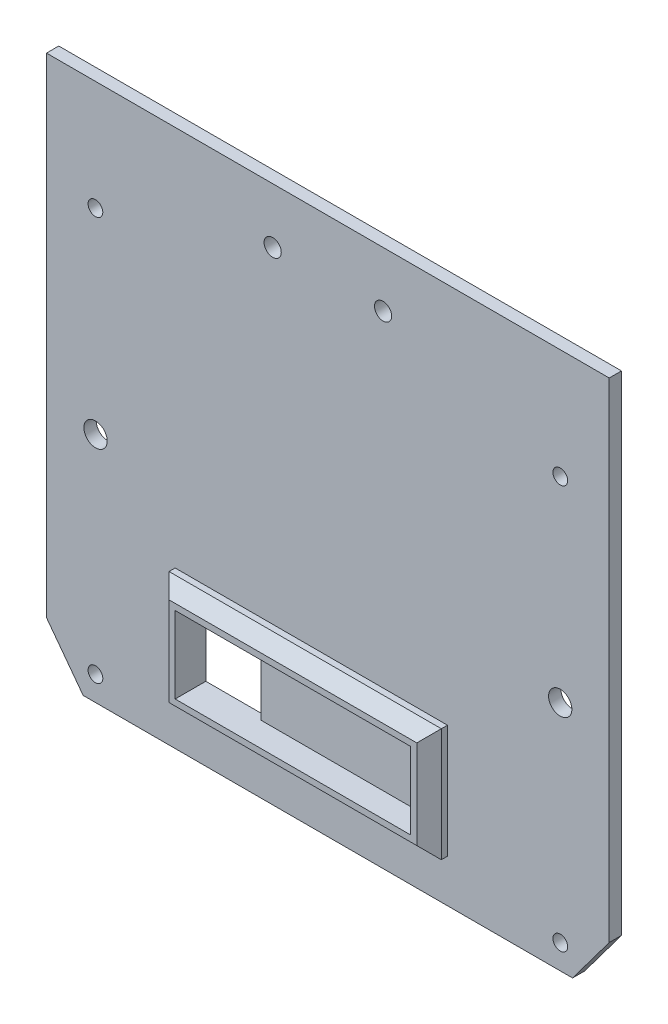
from build123d import *

# Parameters (mm, degrees)
SKETCH_1_W          = 6.2
SKETCH_1_H          = 6.2
SKETCH_1_R          = 1.2
EXTRUDE_1_DEPTH     = 2
CUT_EXTRUDE_1_DEPTH = 1
SKETCH_3_W          = 10
SKETCH_3_H          = 12.5
CUT_EXTRUDE_2_DEPTH = 1
SKETCH_4_W          = 44.4
SKETCH_4_H          = 18.5
SKETCH_4_W_2        = 38.4
SKETCH_4_H_2        = 12.5
EXTRUDE_2_DEPTH     = 3
CHAMFER_2_SIZE      = 2
SKETCH_5_W          = 6.2
SKETCH_5_H          = 6.2
EXTRUDE_3_DEPTH     = 2
CUT_EXTRUDE_3_DEPTH = 10
EXTRUDE_4_DEPTH     = 2
SKETCH_8_R          = 1.9
CUT_EXTRUDE_4_DEPTH = 10


with BuildPart() as part:
    # 草图1 → 凸台-拉伸1 (new body)
    with BuildSketch(Plane.XY):
        Polygon((-68.63, 16.2), (-64.63, 12.2), (-64.63, -37.62), (-68.63, -41.62), (-68.63, -49.62), (11.17, -49.62), (11.17, -41.62), (7.17, -37.62), (7.17, 12.2), (11.17, 16.2), (11.17, 38.1), (-68.63, 38.1), align=None)
        with Locations((-37.93, 28.38)):
            Rectangle(SKETCH_1_W, SKETCH_1_H, mode=Mode.SUBTRACT)
        with Locations((-27.73, 28.38)):
            Rectangle(SKETCH_1_W, SKETCH_1_H, mode=Mode.SUBTRACT)
        with Locations((-66.63, -45.62)):
            Circle(SKETCH_1_R, mode=Mode.SUBTRACT)
        with Locations((9.17, -45.62)):
            Circle(SKETCH_1_R, mode=Mode.SUBTRACT)
        with Locations((-66.63, 20.2)):
            Circle(SKETCH_1_R, mode=Mode.SUBTRACT)
        with Locations((9.17, 20.2)):
            Circle(SKETCH_1_R, mode=Mode.SUBTRACT)
    extrude(amount=EXTRUDE_1_DEPTH)

    # 草图2 → 切除-拉伸1 (cut)
    with BuildSketch(Plane.XY.offset(2)):
        Polygon((-12.23, -27.12), (-39.83, -27.12), (-39.83, -35.02), (-39.83, -39.62), (-12.23, -39.62), align=None)
        Polygon((-39.83, -27.12), (-50.63, -27.12), (-50.63, -39.62), (-39.83, -39.62), (-39.83, -35.02), align=None)
    extrude(amount=-CUT_EXTRUDE_1_DEPTH, mode=Mode.SUBTRACT)

    # 草图3 → 切除-拉伸2 (cut)
    with BuildSketch(Plane.XY.offset(1)):
        with Locations((-45.63, -33.37)):
            Rectangle(SKETCH_3_W, SKETCH_3_H)
    extrude(amount=-CUT_EXTRUDE_2_DEPTH, mode=Mode.SUBTRACT)

    # 草图4 → 凸台-拉伸2 (add)
    with BuildSketch(Plane.XY.offset(2)):
        with Locations((-31.43, -33.37)):
            Rectangle(SKETCH_4_W, SKETCH_4_H)
        with Locations((-31.43, -33.37)):
            Rectangle(SKETCH_4_W_2, SKETCH_4_H_2, mode=Mode.SUBTRACT)
    extrude(amount=EXTRUDE_2_DEPTH)

    # 倒角2
    chamfer_2_edges = [part.edges().sort_by_distance(p)[0] for p in [
        (-31.43, -24.12, 5),
        (-9.23, -33.37, 5),
        (-53.63, -33.37, 5),
        (-31.43, -42.62, 5),
    ]]
    chamfer(chamfer_2_edges, length=CHAMFER_2_SIZE)

    # 草图5 → 凸台-拉伸3 (add)
    with BuildSketch(Plane.XY.offset(2)):
        with Locations((-37.93, 28.38)):
            Rectangle(SKETCH_5_W, SKETCH_5_H)
        with Locations((-27.73, 28.38)):
            Rectangle(SKETCH_5_W, SKETCH_5_H)
    extrude(amount=-EXTRUDE_3_DEPTH)

    # 草图6 → 切除-拉伸3 (cut)
    with BuildSketch(Plane.XY.offset(2)):
        with BuildLine():
            Line((-37.73, 30.5), (-37.73, 29.1))
            Line((-37.73, 29.1), (-36.33, 29.1))
            ThreePointArc((-36.33, 29.1), (-36.740050506, 30.089949494), (-37.73, 30.5))
        make_face()
        with BuildLine():
            Line((-36.33, 29.1), (-37.73, 29.1))
            Line((-37.73, 29.1), (-37.73, 30.5))
            ThreePointArc((-37.73, 30.5), (-38.719949494, 28.110050506), (-36.33, 29.1))
        make_face()
        with BuildLine():
            ThreePointArc((-19.73, 30.5), (-20.719949494, 30.089949494), (-21.13, 29.1))
            Line((-21.13, 29.1), (-19.73, 29.1))
            Line((-19.73, 29.1), (-19.73, 30.5))
        make_face()
        with BuildLine():
            Line((-19.73, 29.1), (-21.13, 29.1))
            ThreePointArc((-21.13, 29.1), (-19.73, 27.7), (-18.33, 29.1))
            ThreePointArc((-18.33, 29.1), (-18.740050506, 30.089949494), (-19.73, 30.5))
            Line((-19.73, 30.5), (-19.73, 29.1))
        make_face()
    extrude(amount=-CUT_EXTRUDE_3_DEPTH, mode=Mode.SUBTRACT)

    # 草图7 → 凸台-拉伸4 (add)
    with BuildSketch(Plane.XY.offset(2)):
        Polygon((-68.63, 38.1), (-74.61, 38.1), (-74.61, -41.62), (-68.63, -41.62), (-64.63, -37.62), (-64.63, 12.2), (-68.63, 16.2), align=None)
        Polygon((17.15, 38.1), (11.17, 38.1), (11.17, 16.2), (7.17, 12.2), (7.17, -37.62), (11.17, -41.62), (17.15, -41.62), align=None)
        Polygon((11.17, -41.62), (11.17, -49.62), (17.15, -41.62), align=None)
        Polygon((-68.63, -41.62), (-74.61, -41.62), (-68.63, -49.62), align=None)
    extrude(amount=-EXTRUDE_4_DEPTH)

    # 草图8 → 切除-拉伸4 (cut)
    with BuildSketch(Plane(origin=(0, 0, 0), x_dir=(-1, 0, 0), z_dir=(0, 0, -1))):
        with Locations((66.61, -11.746314383)):
            Circle(SKETCH_8_R)
        with Locations((-9.156491604, -11.746314383)):
            Circle(SKETCH_8_R)
    extrude(amount=-CUT_EXTRUDE_4_DEPTH, mode=Mode.SUBTRACT)


solid = part.part
